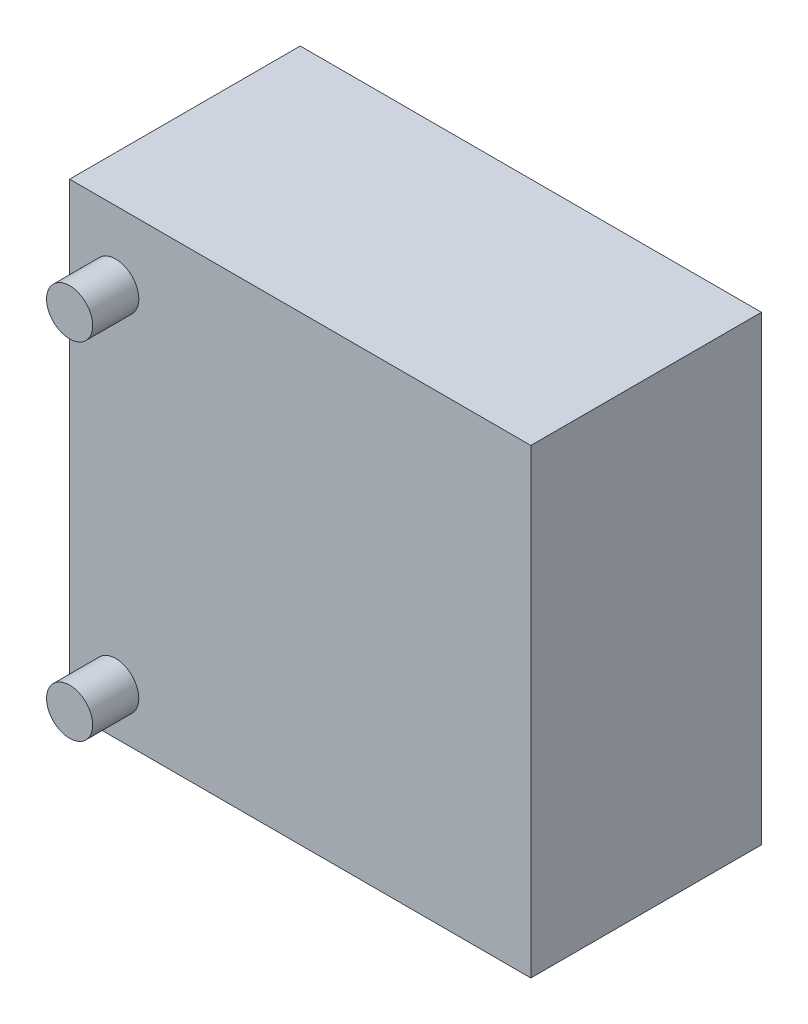
from build123d import *

# Parameters (mm, degrees)
SKETCH_1_W               = 20
SKETCH_1_H               = 20
BASEBOX_DEPTH            = 10
SKETCH_2_R               = 1
BOSSSEED_DEPTH           = 2
LINEARPATTERN_COUNT      = 2
LINEARPATTERN_PITCH      = 10
LINEARPATTERN_COUNT_DIR2 = 3
LINEARPATTERN_PITCH_DIR2 = 15


with BuildPart() as part:
    # 草图1 → BaseBox (new body)
    with BuildSketch(Plane.XY):
        with Locations((10, 10)):
            Rectangle(SKETCH_1_W, SKETCH_1_H)
    extrude(amount=BASEBOX_DEPTH)

    # 草图2 → BossSeed (add)
    with BuildSketch(Plane.XY.offset(10)):
        with Locations((2, 2)):
            Circle(SKETCH_2_R)
    bossseed = extrude(amount=BOSSSEED_DEPTH)

    # LinearPattern: BossSeed 2 × 3, 4 skipped
    with Locations(*[(-i * LINEARPATTERN_PITCH, j * LINEARPATTERN_PITCH_DIR2, 0) for i in range(LINEARPATTERN_COUNT) for j in range(LINEARPATTERN_COUNT_DIR2) if (i, j) not in ((0, 0), (0, 2), (1, 0), (1, 1), (1, 2))]):
        add(bossseed)


solid = part.part
